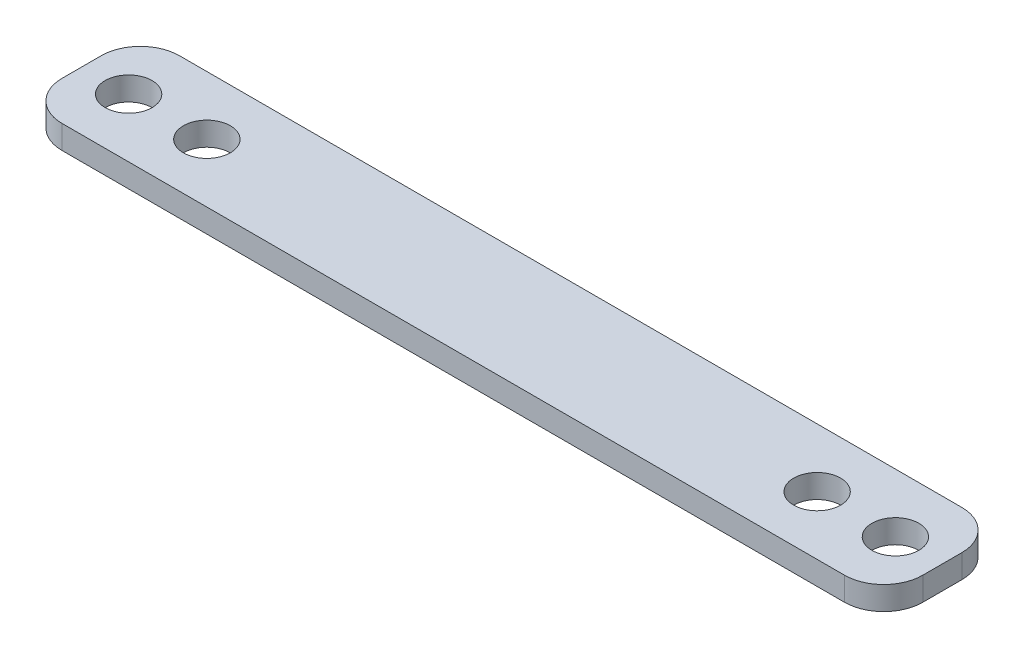
from build123d import *

# Parameters (mm, degrees)
SKETCH1_W           = 110
SKETCH1_H           = 15
BOSS_EXTRUDE1_DEPTH = 3
CUT_EXTRUDE1_REACH  = 57.59
SKETCH2_R           = 3
FILLET1_R           = 5


with BuildPart() as part:
    # Sketch1 → Boss-Extrude1 (new body)
    with BuildSketch(Plane(origin=(0, 0, 0), x_dir=(1, 0, 0), z_dir=(0, 1, 0))):
        Rectangle(SKETCH1_W, SKETCH1_H)
    extrude(amount=BOSS_EXTRUDE1_DEPTH)

    # Sketch2 → Cut-Extrude1 (cut, up to next)
    with BuildSketch(Plane(origin=(0, 3, 0), x_dir=(1, 0, 0), z_dir=(0, 1, 0)), mode=Mode.PRIVATE) as cut_extrude1_sk1:
        with Locations(Location((-49, 0, 0), (0, 0, 270))):
            Circle(SKETCH2_R)
    cut_extrude1_tool1 = extrude(cut_extrude1_sk1.sketch, amount=-CUT_EXTRUDE1_REACH, mode=Mode.PRIVATE) & part.part
    # Sketch2 → Cut-Extrude1 (cut, up to next)
    with BuildSketch(Plane(origin=(0, 3, 0), x_dir=(1, 0, 0), z_dir=(0, 1, 0)), mode=Mode.PRIVATE) as cut_extrude1_sk2:
        with Locations(Location((-39, 0, 0), (0, 0, 270))):
            Circle(SKETCH2_R)
    cut_extrude1_tool2 = extrude(cut_extrude1_sk2.sketch, amount=-CUT_EXTRUDE1_REACH, mode=Mode.PRIVATE) & part.part
    cut_extrude1_1 = cut_extrude1_tool1.solids().sort_by_distance((-49, 3, 0))[0]
    add(cut_extrude1_1, mode=Mode.SUBTRACT)
    cut_extrude1_2 = cut_extrude1_tool2.solids().sort_by_distance((-39, 3, 0))[0]
    add(cut_extrude1_2, mode=Mode.SUBTRACT)
    cut_extrude1 = cut_extrude1_1 + cut_extrude1_2  # Cut-Extrude1 as one shape, for the pattern or mirror that repeats it

    # Mirror1: Cut-Extrude1 across plane
    add(cut_extrude1.mirror(Plane(origin=(0, 0, 0), x_dir=(0, 0, 1), z_dir=(1, 0, 0))), mode=Mode.SUBTRACT)

    # Fillet1
    fillet1_edges = [part.edges().sort_by_distance(p)[0] for p in [
        (-55, 1.5, -7.5),
        (55, 1.5, -7.5),
        (55, 1.5, 7.5),
        (-55, 1.5, 7.5),
    ]]
    fillet(fillet1_edges, radius=FILLET1_R)


solid = part.part
